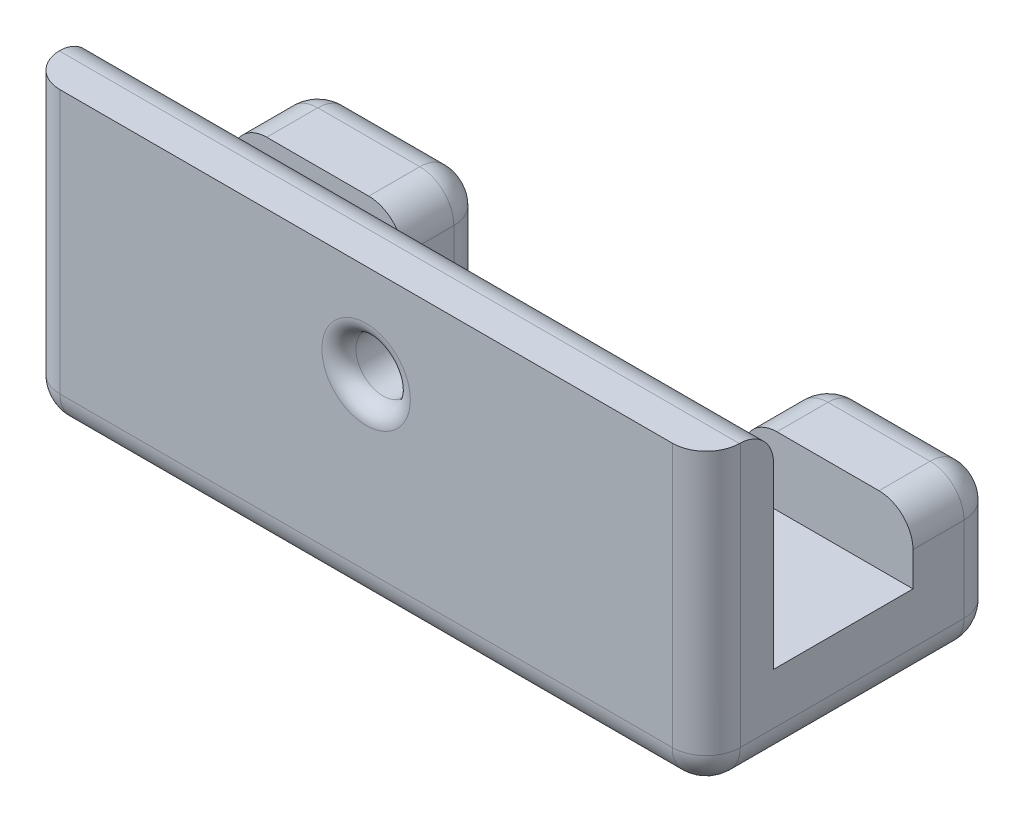
from build123d import *

# Parameters (mm, degrees)
BOSS_EXTRUDE1_DEPTH = 5
SKETCH1_3_W         = 10
SKETCH1_3_H         = 5
BOSS_EXTRUDE2_DEPTH = 9
SKETCH2_W           = 40
SKETCH2_H           = 3.955098896
BOSS_EXTRUDE4_DEPTH = 12.5
FILLET1_R           = 2
SKETCH6_R           = 1.6
CUT_EXTRUDE1_DEPTH  = 3.955098897
FILLET2_R           = 1
FILLET3_R           = 2


with BuildPart() as part:
    # Sketch1 → Boss-Extrude1 (new body)
    with BuildSketch(Plane(origin=(0, 0, 0), x_dir=(1, 0, 0), z_dir=(0, 1, 0))):
        Polygon((-4.61462686, -18.720861087), (-14.61462686, -18.720861087), (-14.61462686, -25.920861087), (-34.61462686, -25.920861087), (-34.61462686, -18.720861087), (-44.61462686, -18.720861087), (-44.61462686, -35.875959983), (-4.61462686, -35.875959983), align=None)
    extrude(amount=BOSS_EXTRUDE1_DEPTH)

    # Sketch1<3> → Boss-Extrude2 (add)
    with BuildSketch(Plane(origin=(0, 0, 0), x_dir=(1, 0, 0), z_dir=(0, 1, 0))):
        with Locations((-39.61462686, -21.220861087)):
            Rectangle(SKETCH1_3_W, SKETCH1_3_H)
        with Locations((-9.61462686, -21.220861087)):
            Rectangle(SKETCH1_3_W, SKETCH1_3_H)
    extrude(amount=BOSS_EXTRUDE2_DEPTH)

    # Sketch2 → Boss-Extrude4 (add)
    with BuildSketch(Plane(origin=(0, 5, 0), x_dir=(1, 0, 0), z_dir=(0, 1, 0))):
        with Locations((-24.61462686, -33.898410535)):
            Rectangle(SKETCH2_W, SKETCH2_H)
    extrude(amount=BOSS_EXTRUDE4_DEPTH)

    # Fillet1
    fillet1_edges = [part.edges().sort_by_distance(p)[0] for p in [
        (-34.61462686, 0, 22.320861087),
        (-24.61462686, 0, 25.920861087),
        (-14.61462686, 0, 22.320861087),
        (-9.61462686, 0, 18.720861087),
        (-4.61462686, 0, 27.298410535),
        (-24.61462686, 0, 35.875959983),
        (-44.61462686, 0, 27.298410535),
        (-44.61462686, 4.5, 18.720861087),
        (-34.61462686, 4.5, 18.720861087),
        (-14.61462686, 4.5, 18.720861087),
        (-4.61462686, 4.5, 18.720861087),
        (-4.61462686, 8.75, 35.875959983),
        (-44.61462686, 8.75, 35.875959983),
        (-24.61462686, 5, 25.920861087),
        (-39.61462686, 9, 18.720861087),
        (-44.61462686, 9, 21.220861087),
        (-34.61462686, 9, 21.220861087),
        (-14.61462686, 9, 21.220861087),
        (-4.61462686, 9, 21.220861087),
        (-9.61462686, 9, 18.720861087),
        (-39.61462686, 0, 18.720861087),
    ]]
    fillet(fillet1_edges, radius=FILLET1_R)

    # Sketch6 → Cut-Extrude1 (cut)
    with BuildSketch(Plane(origin=(0, 0, 31.920861087), x_dir=(-1, 0, 0), z_dir=(0, 0, -1))):
        with Locations((24.61462686, 12)):
            Circle(SKETCH6_R)
    extrude(amount=-CUT_EXTRUDE1_DEPTH, mode=Mode.SUBTRACT)

    # Fillet2
    fillet2_edges = [part.edges().sort_by_distance(p)[0] for p in [
        (-23.01462686, 12, 31.920861087),
        (-23.01462686, 12, 35.875959984),
    ]]
    fillet(fillet2_edges, radius=FILLET2_R)

    # Fillet3
    fillet3_edges = [part.edges().sort_by_distance(p)[0] for p in [
        (-24.61462686, 17.5, 31.920861087),
    ]]
    fillet(fillet3_edges, radius=FILLET3_R)


solid = part.part
